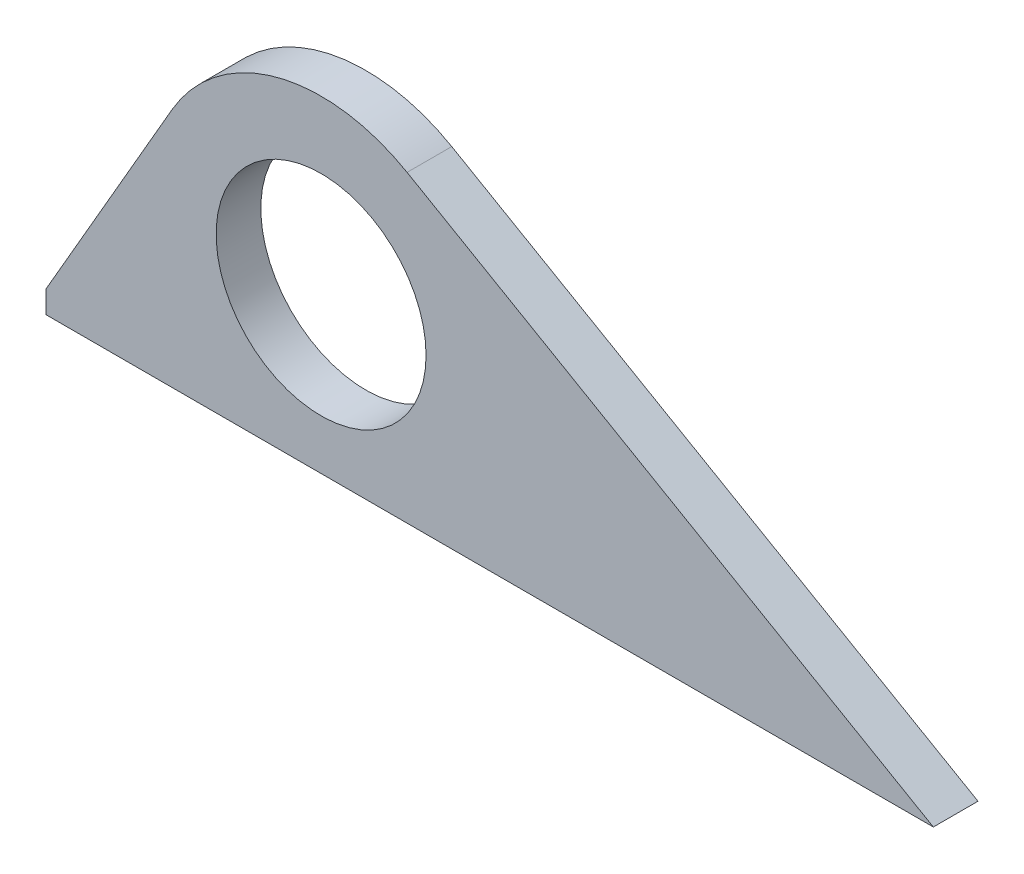
from build123d import *

# Parameters (mm, degrees)
ESQUISSE1_R        = 23.5
BOSS_EXTRU_1_DEPTH = 10


with BuildPart() as part:
    # Esquisse1 → Boss.-Extru.1 (new body)
    with BuildSketch(Plane.XY):
        with BuildLine():
            Line((0, 0), (190, 0))
            Line((190, 0), (198.660254038, 0))
            Line((198.660254038, 0), (190, 5))
            Line((190, 5), (80.841978046, 68.02241336))
            ThreePointArc((80.841978046, 68.02241336), (51.627444809, 71.868579626), (28.25, 53.930435314))
            Line((28.25, 53.930435314), (0, 5))
            Line((0, 5), (0, 0))
        make_face()
        with Locations((61.591978046, 34.680435314)):
            Circle(ESQUISSE1_R, mode=Mode.SUBTRACT)
    extrude(amount=BOSS_EXTRU_1_DEPTH)


solid = part.part
